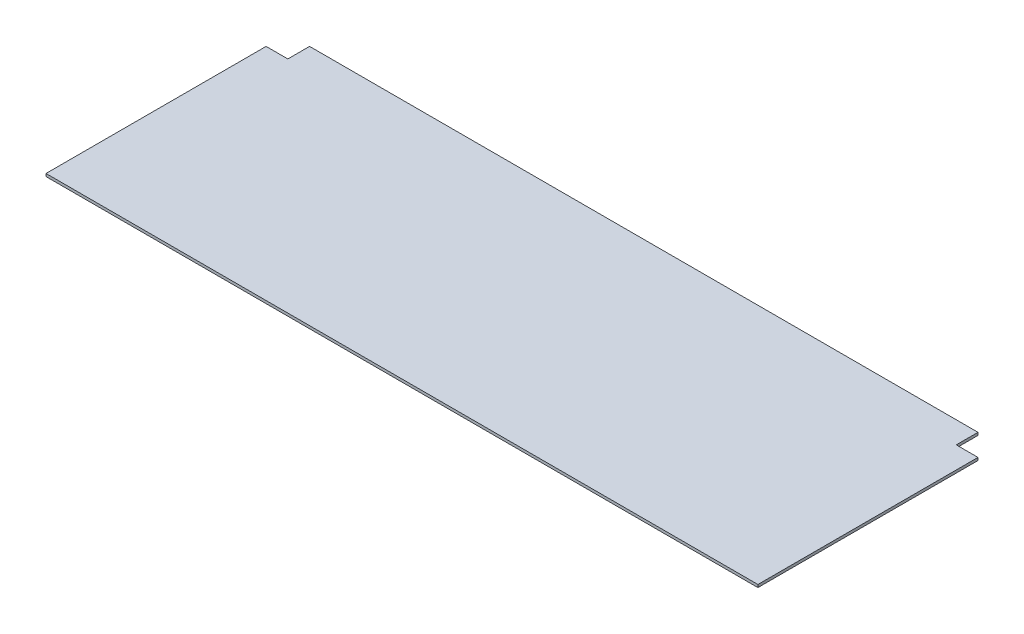
from build123d import *

# Parameters (mm, degrees)
BOSS_EXTRUDE1_DEPTH = 6.35


with BuildPart() as part:
    # Sketch1 → Boss-Extrude1 (new body)
    with BuildSketch(Plane(origin=(0, 0, 0), x_dir=(1, 0, 0), z_dir=(0, 1, 0))):
        Polygon((-831.85, 231.775), (-831.85, -282.575), (831.85, -282.575), (831.85, 231.775), (781.05, 231.775), (781.05, 282.575), (-781.05, 282.575), (-781.05, 231.775), align=None)
    extrude(amount=BOSS_EXTRUDE1_DEPTH)


solid = part.part
